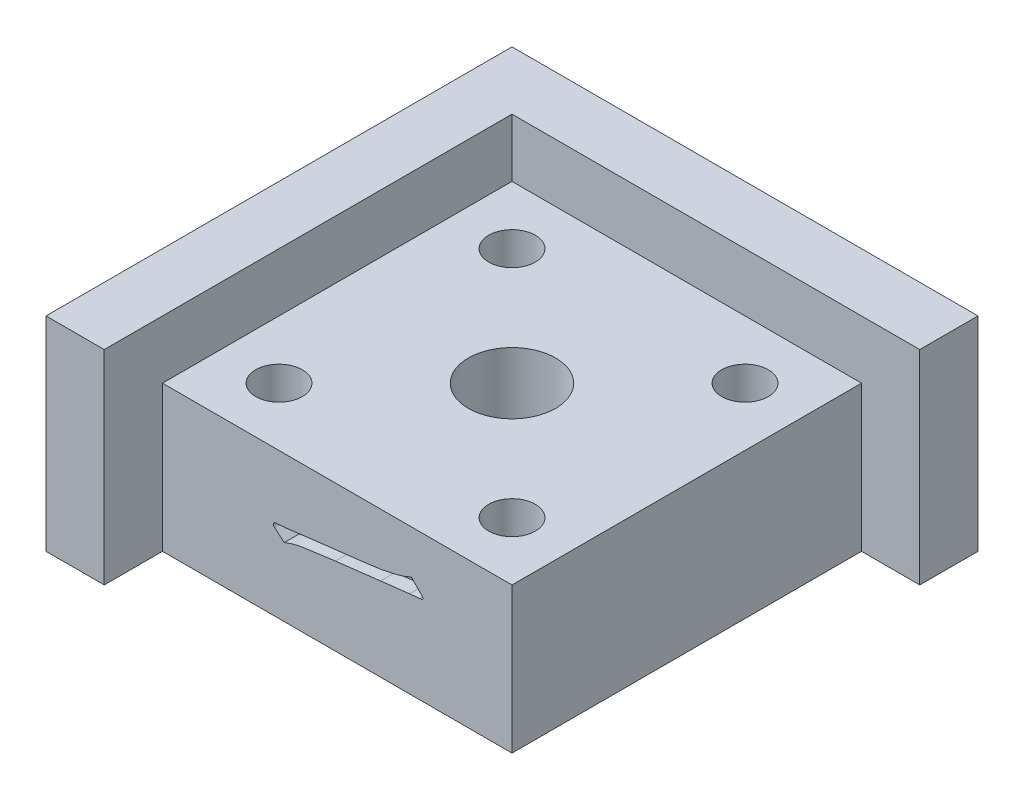
from build123d import *

# Parameters (mm, degrees)
SKETCH1_W           = 12
SKETCH1_H           = 12
BOSS_EXTRUDE1_DEPTH = 3
SHELL2_T            = -1.8
SKETCH3_R           = 1.5
CUT_EXTRUDE3_DEPTH  = 1.8
BOSS_EXTRUDE2_START = 2
SKETCH3_3_W         = 16
SKETCH3_3_H         = 16
SKETCH3_3_W_2       = 12
SKETCH3_3_H_2       = 12
SKETCH3_3_R         = 1.5
BOSS_EXTRUDE2_DEPTH = 2
SKETCH4_W           = 14
SKETCH4_H           = 2
BOSS_EXTRUDE3_DEPTH = 2
SKETCH5_W           = 16
SKETCH5_H           = 16
SKETCH5_W_2         = 12
SKETCH5_H_2         = 12
BOSS_EXTRUDE4_DEPTH = 3
SKETCH6_W           = 14
SKETCH6_H           = 5
CUT_EXTRUDE4_DEPTH  = 2
SKETCH7_W           = 12
SKETCH7_H           = 5
CUT_EXTRUDE5_DEPTH  = 2
CUT_EXTRUDE6_DEPTH  = 0.5
SKETCH9_R           = 0.8
CUT_EXTRUDE7_DEPTH  = 21.420577881


with BuildPart() as part:
    # Sketch1 → Boss-Extrude1 (new body)
    with BuildSketch(Plane(origin=(0, 0, 0), x_dir=(1, 0, 0), z_dir=(0, 1, 0))):
        with Locations((6, -6)):
            Rectangle(SKETCH1_W, SKETCH1_H)
    extrude(amount=-BOSS_EXTRUDE1_DEPTH)

    # Shell2
    shell2_openings = [part.faces().sort_by_distance(p)[0] for p in [
        (6, -3, 6),
    ]]
    offset(amount=SHELL2_T, openings=shell2_openings, kind=Kind.INTERSECTION)

    # Sketch3 → Cut-Extrude3 (cut)
    with BuildSketch(Plane(origin=(0, 0, 0), x_dir=(1, 0, 0), z_dir=(0, 1, 0))):
        with Locations(Location((6, -6, 0), (0, 0, 270))):
            Circle(SKETCH3_R)
    extrude(amount=-CUT_EXTRUDE3_DEPTH, mode=Mode.SUBTRACT)

    # Sketch3<3> → Boss-Extrude2 (add)
    # profile 1 of 2: a face of its own
    with BuildSketch(Plane(origin=(0, 0, 0), x_dir=(1, 0, 0), z_dir=(0, 1, 0)).offset(BOSS_EXTRUDE2_START)):
        with Locations((6, -6)):
            Rectangle(SKETCH3_3_W, SKETCH3_3_H)
        with Locations((6, -6)):
            Rectangle(SKETCH3_3_W_2, SKETCH3_3_H_2, mode=Mode.SUBTRACT)
    # profile 2 of 2: a face of its own
    with BuildSketch(Plane(origin=(0, 0, 0), x_dir=(1, 0, 0), z_dir=(0, 1, 0)).offset(BOSS_EXTRUDE2_START)):
        with Locations((6, -6)):
            Rectangle(SKETCH3_3_W_2, SKETCH3_3_H_2)
        with Locations(Location((6, -6, 0), (0, 0, 270))):
            Circle(SKETCH3_3_R, mode=Mode.SUBTRACT)
    extrude(amount=-BOSS_EXTRUDE2_DEPTH)

    # Sketch4 → Boss-Extrude3 (add)
    with BuildSketch(Plane(origin=(0, 2, 0), x_dir=(1, 0, 0), z_dir=(0, 1, 0))):
        Polygon((0, 2), (-2, 2), (-2, -14), (0, -14), (0, 0), align=None)
        with Locations((7, 1)):
            Rectangle(SKETCH4_W, SKETCH4_H)
    extrude(amount=BOSS_EXTRUDE3_DEPTH)

    # Sketch5 → Boss-Extrude4 (add)
    with BuildSketch(Plane.XZ):
        with Locations((6, 6)):
            Rectangle(SKETCH5_W, SKETCH5_H)
        with Locations((6, 6)):
            Rectangle(SKETCH5_W_2, SKETCH5_H_2, mode=Mode.SUBTRACT)
    extrude(amount=BOSS_EXTRUDE4_DEPTH)

    # Sketch6 → Cut-Extrude4 (cut)
    with BuildSketch(Plane.XY.offset(14)):
        with Locations((7, -0.5)):
            Rectangle(SKETCH6_W, SKETCH6_H)
    extrude(amount=-CUT_EXTRUDE4_DEPTH, mode=Mode.SUBTRACT)

    # Sketch7 → Cut-Extrude5 (cut)
    with BuildSketch(Plane(origin=(14, 0, 0), x_dir=(0, 0, -1), z_dir=(1, 0, 0))):
        with Locations((-6, -0.5)):
            Rectangle(SKETCH7_W, SKETCH7_H)
    extrude(amount=-CUT_EXTRUDE5_DEPTH, mode=Mode.SUBTRACT)

    # Sketch8 → Cut-Extrude6 (cut)
    with BuildSketch(Plane.XY.offset(12)):
        with BuildLine():
            Line((5.499365182, -0.030316533), (6.944147055, 0.139116978))
            add(Edge.make_bspline(
                [(6.944147055, 0.139116978), (7.033959338, 0.149589911), (7.207292534, 0.169802147), (7.456935343, 0.206659273), (7.686554115, 0.246864239), (7.896440991, 0.291462829), (8.086108286, 0.339865769), (8.256388111, 0.390049541), (8.406137381, 0.446305372), (8.496905896, 0.49005931), (8.539974305, 0.51081995)],
                knots=[0, 0, 0, 0, 1.318163599, 2.543989528, 3.678365744, 4.716171039, 5.671329954, 6.531514493, 7.303223867, 8, 8, 8, 8], degree=3))
            Line((8.539974305, 0.51081995), (8.894602583, 0.146997606))
            add(Edge.make_bspline(
                [(8.894602583, 0.146997606), (8.903504519, 0.13774703), (8.91939642, 0.121232731), (8.933040884, 0.094560662), (8.942770969, 0.072093955), (8.937635666, 0.051580559), (8.925089845, 0.034251106), (8.900964781, 0.024529461), (8.870149866, 0.016869042), (8.846087974, 0.015236889), (8.832870994, 0.014340361)],
                knots=[0, 0, 0, 0, 1.361923056, 2.431330196, 3.216705747, 3.88751825, 4.590291911, 5.428398407, 6.587442422, 8, 8, 8, 8], degree=3))
            Line((8.832870994, 0.014340361), (8.478242716, -0.021122466))
            Line((8.478242716, -0.021122466), (7.485283538, -0.136705016))
            Line((7.485283538, -0.136705016), (5.934113182, -0.321899783))
            add(Edge.make_bspline(
                [(5.934113182, -0.321899783), (5.850481605, -0.332333939), (5.69237844, -0.352059419), (5.468673749, -0.381100719), (5.271621052, -0.407112207), (5.100999285, -0.431234493), (4.956401672, -0.450505772), (4.838594823, -0.467397889), (4.747497081, -0.481707682), (4.65962381, -0.49747077), (4.562769862, -0.520689248), (4.443406404, -0.552923227), (4.314473425, -0.598718655), (4.224826658, -0.63258625), (4.178046488, -0.6502593)],
                knots=[0, 0, 0, 0, 1.692798098, 3.200187617, 4.530910958, 5.684993954, 6.661249462, 7.46089318, 8.075318241, 8.513415889, 9.253600346, 10.074996663, 10.995479859, 12, 12, 12, 12], degree=3))
            Line((4.178046488, -0.6502593), (3.85100041, -0.366556678))
            add(Edge.make_bspline(
                [(3.85100041, -0.366556678), (3.838610297, -0.356171923), (3.812805776, -0.334543902), (3.803900048, -0.290524917), (3.80934915, -0.25628733), (3.825603847, -0.233888183), (3.853323458, -0.221153848), (3.874526491, -0.217543712), (3.886463237, -0.2155113)],
                knots=[0, 0, 0, 0, 1.325695646, 2.760987115, 3.510625552, 4.19429037, 4.983433253, 6, 6, 6, 6], degree=3))
            Line((3.886463237, -0.2155113), (4.276554343, -0.180048472))
            Line((4.276554343, -0.180048472), (5.499365182, -0.030316533))
        make_face()
    extrude(amount=-CUT_EXTRUDE6_DEPTH, mode=Mode.SUBTRACT)

    # Sketch9 → Cut-Extrude7 (cut, through all)
    with BuildSketch(Plane(origin=(0, 2, 0), x_dir=(1, 0, 0), z_dir=(0, 1, 0))):
        with Locations(Location((2, -10, 0), (0, 0, 270))):
            Circle(SKETCH9_R)
        with Locations(Location((10, -10, 0), (0, 0, 270))):
            Circle(SKETCH9_R)
        with Locations(Location((2, -2, 0), (0, 0, 270))):
            Circle(SKETCH9_R)
        with Locations(Location((10, -2, 0), (0, 0, 270))):
            Circle(SKETCH9_R)
    extrude(amount=-CUT_EXTRUDE7_DEPTH, mode=Mode.SUBTRACT)


solid = part.part
